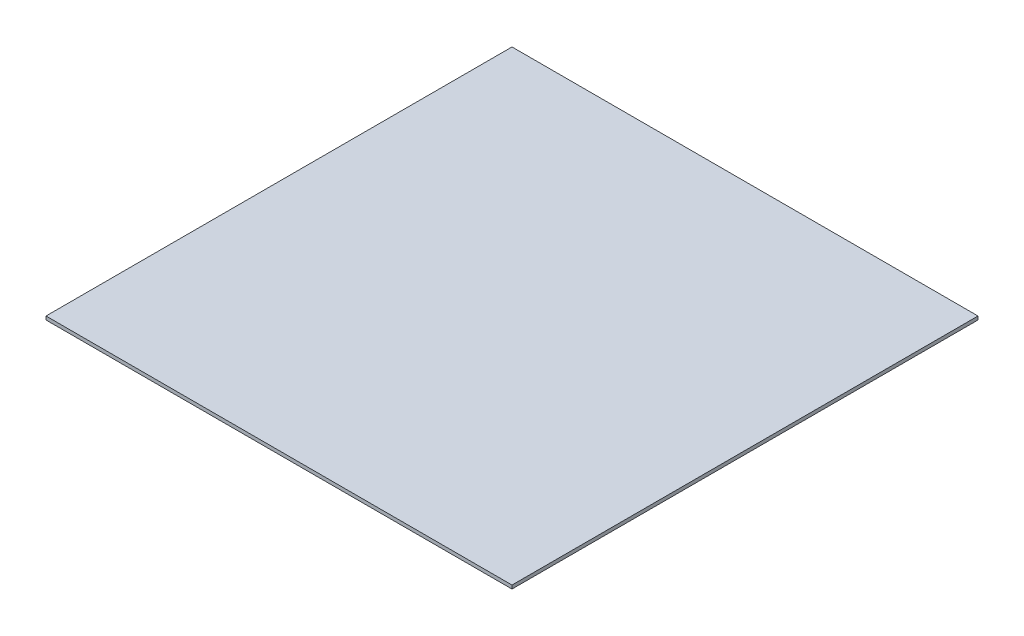
from build123d import *

# Parameters (mm, degrees)
SKETCH1_W           = 213.5
SKETCH1_H           = 213.5
BOSS_EXTRUDE1_DEPTH = 1.6


with BuildPart() as part:
    # Sketch1 → Boss-Extrude1 (new body)
    with BuildSketch(Plane(origin=(0, 0, 0), x_dir=(1, 0, 0), z_dir=(0, 1, 0))):
        Rectangle(SKETCH1_W, SKETCH1_H)
    extrude(amount=BOSS_EXTRUDE1_DEPTH)


solid = part.part
